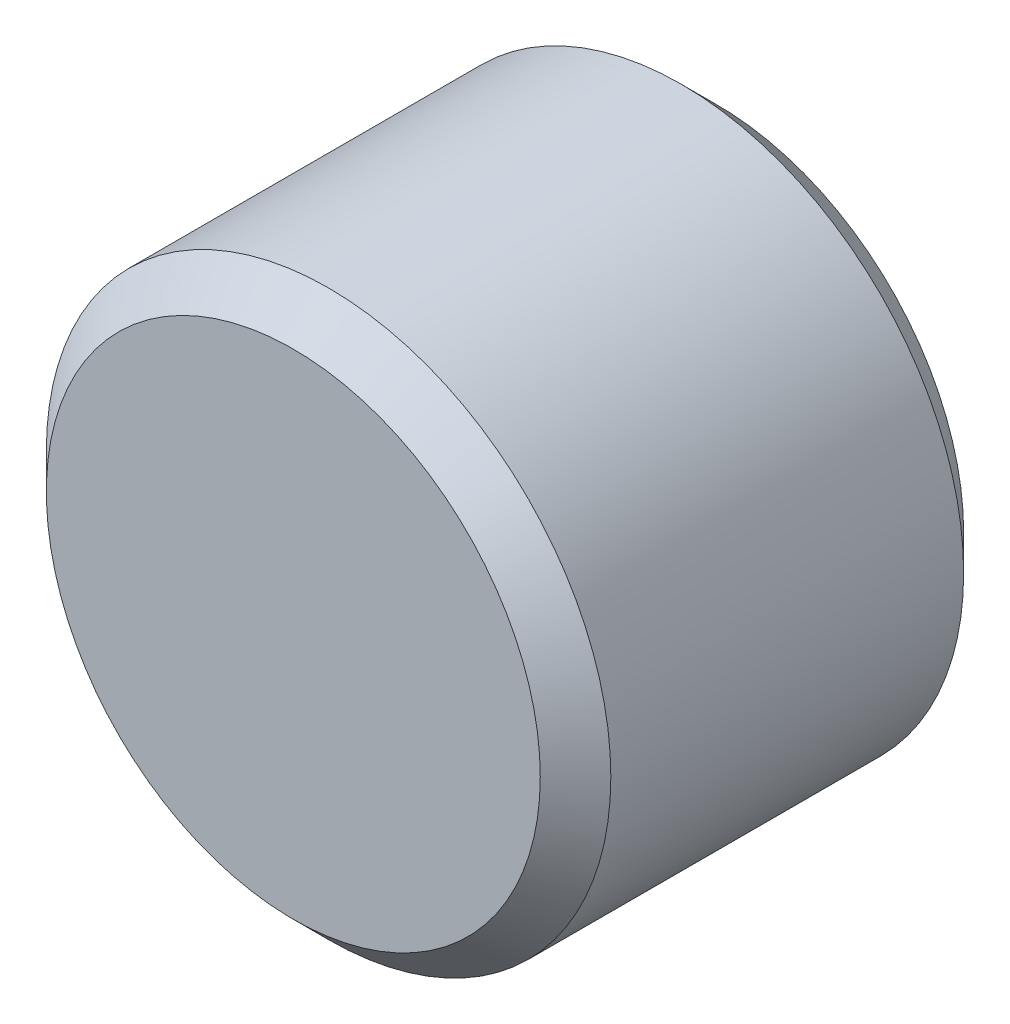
from build123d import *

# Parameters (mm, degrees)
SKETCH1_R           = 4
BOSS_EXTRUDE1_DEPTH = 6
CHAMFER1_SIZE       = 0.5


with BuildPart() as part:
    # Sketch1 → Boss-Extrude1 (new body)
    with BuildSketch(Plane.XY):
        Circle(SKETCH1_R)
    extrude(amount=BOSS_EXTRUDE1_DEPTH)

    # Chamfer1
    chamfer1_edges = [part.edges().sort_by_distance(p)[0] for p in [
        (-4, 0, 0),
        (-4, 0, 6),
    ]]
    chamfer(chamfer1_edges, length=CHAMFER1_SIZE)


solid = part.part
